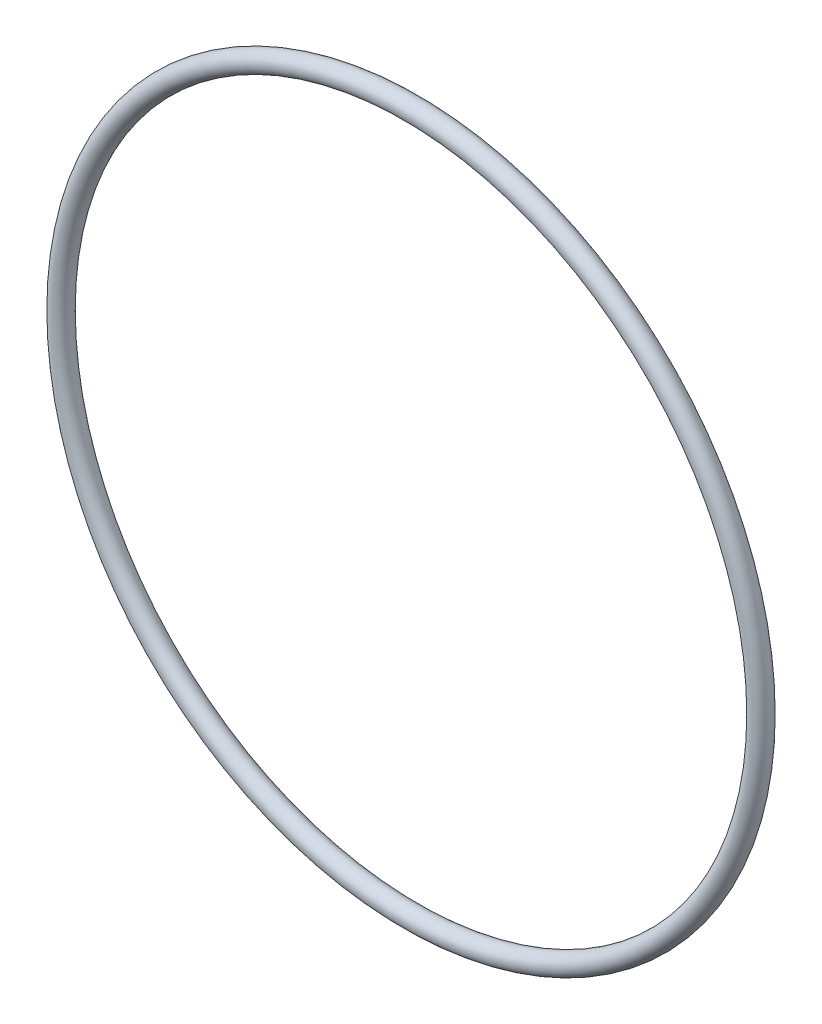
from build123d import *

# Parameters (mm, degrees)
BASE_SWEEP_PROFILE_R = 1.5875


with BuildPart() as part:
    # Base-Sweep: sweep along a path in Sketch1
    with BuildLine(Plane.XY) as base_sweep_path:
        CenterArc((0, 0), 55.245, 0, 360)
    # Base-Sweep profile (on start of the path) → Base-Sweep (sweep)
    with BuildSketch(Plane(origin=(55.245, 0, 0), x_dir=(0, 0, 1), z_dir=(0, 1, 0))):
        Circle(BASE_SWEEP_PROFILE_R)
    sweep(path=base_sweep_path.line)


solid = part.part
